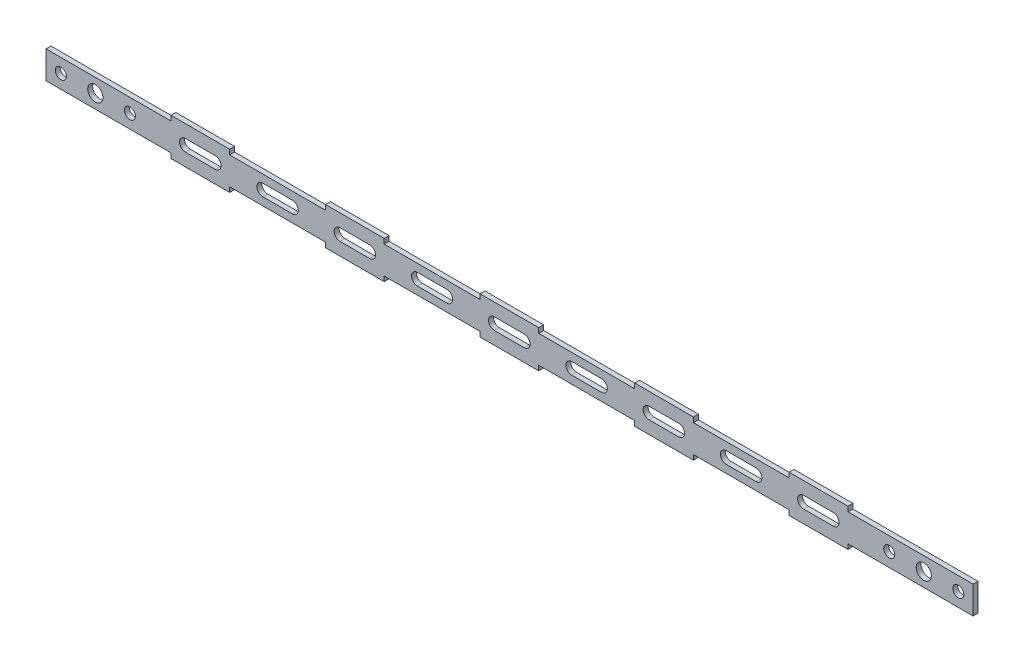
from build123d import *

# Parameters (mm, degrees)
SKETCH1_W           = 596.9
SKETCH1_H           = 17.78
BOSS_EXTRUDE1_DEPTH = 3.175
SKETCH3_W           = 37.846
SKETCH3_H           = 3.175
BOSS_EXTRUDE2_DEPTH = 3.175
SKETCH4_R           = 3.556
SKETCH4_R_2         = 4.8895
CUT_EXTRUDE1_DEPTH  = 299.710641508
CUT_EXTRUDE3_DEPTH  = 299.710641508


with BuildPart() as part:
    # Sketch1 → Boss-Extrude1 (new body)
    with BuildSketch(Plane.XY):
        Rectangle(SKETCH1_W, SKETCH1_H)
    extrude(amount=BOSS_EXTRUDE1_DEPTH)

    # Sketch3 → Boss-Extrude2 (add)
    with BuildSketch(Plane(origin=(0, 8.89, 0), x_dir=(1, 0, 0), z_dir=(0, 1, 0))):
        with Locations((-199.093666667, -1.5875)):
            Rectangle(SKETCH3_W, SKETCH3_H)
        with Locations((-99.610333333, -1.5875)):
            Rectangle(SKETCH3_W, SKETCH3_H)
        with Locations((-0.127, -1.5875)):
            Rectangle(SKETCH3_W, SKETCH3_H)
        with Locations((99.483333333, -1.5875)):
            Rectangle(SKETCH3_W, SKETCH3_H)
        with Locations((198.966666751, -1.5875)):
            Rectangle(SKETCH3_W, SKETCH3_H)
    boss_extrude2 = extrude(amount=BOSS_EXTRUDE2_DEPTH)

    # Mirror1: Boss-Extrude2 across plane
    add(boss_extrude2.mirror(Plane.ZX))

    # Sketch4 → Cut-Extrude1 (cut, through all)
    with BuildSketch(Plane(origin=(0, 0, 0), x_dir=(-1, 0, 0), z_dir=(0, 0, -1))):
        with Locations((-288.925, 0)):
            Circle(SKETCH4_R)
        with Locations((-244.475, 0)):
            Circle(SKETCH4_R)
        with Locations((-266.7, 0)):
            Circle(SKETCH4_R_2)
    cut_extrude1 = extrude(amount=-CUT_EXTRUDE1_DEPTH, mode=Mode.SUBTRACT)

    # Mirror2: Cut-Extrude1 across plane
    add(cut_extrude1.mirror(Plane(origin=(0, 0, 0), x_dir=(0, 0, 1), z_dir=(1, 0, 0))), mode=Mode.SUBTRACT)

    # Sketch6 → Cut-Extrude3 (cut, through all)
    with BuildSketch(Plane.XY.offset(3.175)):
        with BuildLine():
            Line((-208.618666667, 3.81), (-189.568666667, 3.81))
            ThreePointArc((-189.568666667, 3.81), (-185.758666667, 0), (-189.568666667, -3.81))
            Line((-189.568666667, -3.81), (-208.618666667, -3.81))
            ThreePointArc((-208.618666667, -3.81), (-212.428666667, 0), (-208.618666667, 3.81))
        make_face()
        with BuildLine():
            Line((-109.135333333, 3.81), (-90.085333333, 3.81))
            ThreePointArc((-90.085333333, 3.81), (-86.275333333, 0), (-90.085333333, -3.81))
            Line((-90.085333333, -3.81), (-109.135333333, -3.81))
            ThreePointArc((-109.135333333, -3.81), (-112.945333333, 0), (-109.135333333, 3.81))
        make_face()
        with BuildLine():
            Line((-9.652, 3.81), (9.398, 3.81))
            ThreePointArc((9.398, 3.81), (13.208, 0), (9.398, -3.81))
            Line((9.398, -3.81), (-9.652, -3.81))
            ThreePointArc((-9.652, -3.81), (-13.462, 0), (-9.652, 3.81))
        make_face()
        with BuildLine():
            Line((89.831333333, 3.81), (108.881333333, 3.81))
            ThreePointArc((108.881333333, 3.81), (112.691333333, 0), (108.881333333, -3.81))
            Line((108.881333333, -3.81), (89.831333333, -3.81))
            ThreePointArc((89.831333333, -3.81), (86.021333333, 0), (89.831333333, 3.81))
        make_face()
        with BuildLine():
            Line((189.314666667, 3.81), (208.364666667, 3.81))
            ThreePointArc((208.364666667, 3.81), (212.174666667, 0), (208.364666667, -3.81))
            Line((208.364666667, -3.81), (189.314666667, -3.81))
            ThreePointArc((189.314666667, -3.81), (185.504666667, 0), (189.314666667, 3.81))
        make_face()
        with BuildLine():
            Line((-158.877, 3.81), (-139.827, 3.81))
            ThreePointArc((-139.827, 3.81), (-136.017, 0), (-139.827, -3.81))
            Line((-139.827, -3.81), (-158.877, -3.81))
            ThreePointArc((-158.877, -3.81), (-162.687, 0), (-158.877, 3.81))
        make_face()
        with BuildLine():
            Line((-59.319456458, 3.81), (-40.417876875, 3.81))
            ThreePointArc((-40.417876875, 3.81), (-36.607876875, 0), (-40.417876875, -3.81))
            Line((-40.417876875, -3.81), (-59.319456458, -3.81))
            ThreePointArc((-59.319456458, -3.81), (-63.129456458, 0), (-59.319456458, 3.81))
        make_face()
        with BuildLine():
            Line((40.089666667, 3.81), (59.139666667, 3.81))
            ThreePointArc((59.139666667, 3.81), (62.949666667, 0), (59.139666667, -3.81))
            Line((59.139666667, -3.81), (40.089666667, -3.81))
            ThreePointArc((40.089666667, -3.81), (36.279666667, 0), (40.089666667, 3.81))
        make_face()
        with BuildLine():
            Line((139.573, 3.81), (158.623, 3.81))
            ThreePointArc((158.623, 3.81), (162.433, 0), (158.623, -3.81))
            Line((158.623, -3.81), (139.573, -3.81))
            ThreePointArc((139.573, -3.81), (135.763, 0), (139.573, 3.81))
        make_face()
    extrude(amount=-CUT_EXTRUDE3_DEPTH, mode=Mode.SUBTRACT)


solid = part.part
